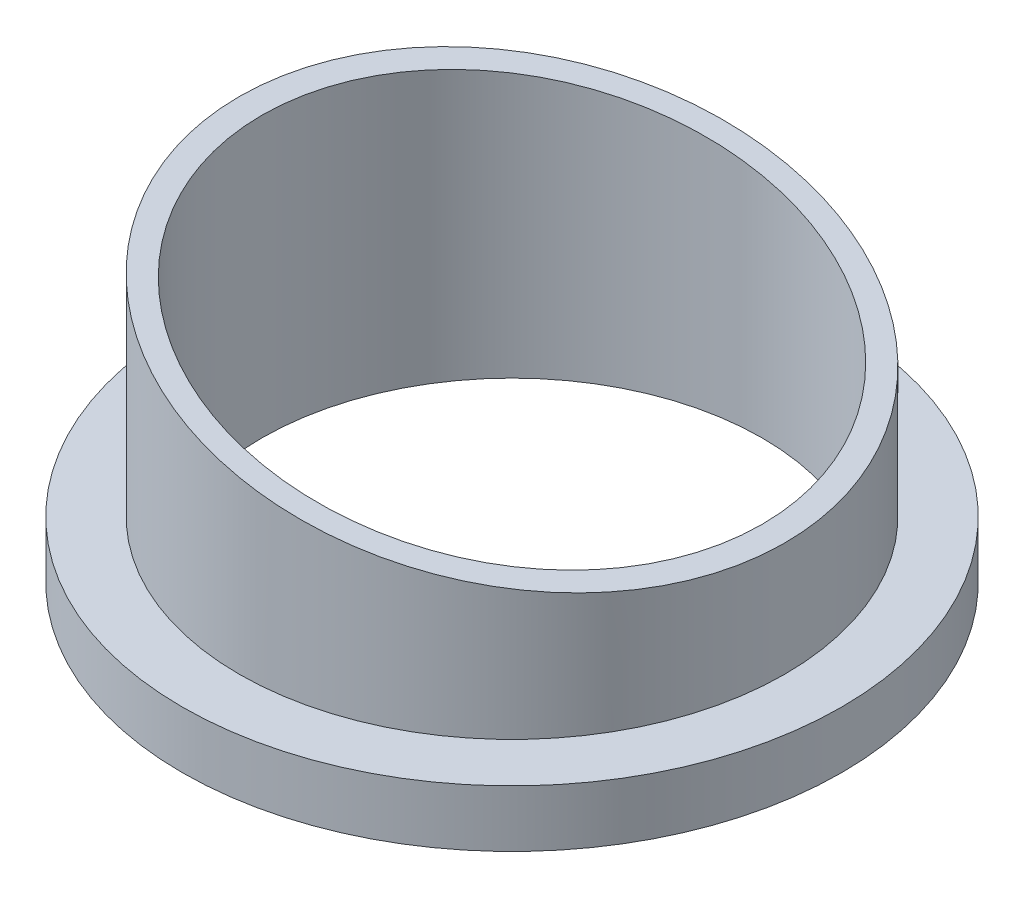
from build123d import *

# Parameters (mm, degrees)
SKETCH1_R               = 14.5
BOSS_EXTRUDE1_DEPTH     = 12.5
CUT_EXTRUDE1_START      = -10
SKETCH2_R               = 14.5
SKETCH2_R_2             = 12
CUT_EXTRUDE1_DEPTH      = 10
SKETCH4_R               = 11
CUT_EXTRUDE2_DEPTH      = 25.015619917
CUT_EXTRUDE3_DEPTH      = 25.015619917
CUT_EXTRUDE3_DEPTH_BACK = 25.015619917


with BuildPart() as part:
    # Sketch1 → Boss-Extrude1 (new body)
    with BuildSketch(Plane(origin=(0, 0, 0), x_dir=(1, 0, 0), z_dir=(0, 1, 0))):
        with Locations(Location((0, 0, 0), (0, 0, 270))):
            Circle(SKETCH1_R)
    extrude(amount=BOSS_EXTRUDE1_DEPTH)

    # Sketch2 → Cut-Extrude1 (cut)
    with BuildSketch(Plane(origin=(0, 12.5, 0), x_dir=(1, 0, 0), z_dir=(0, 1, 0)).offset(CUT_EXTRUDE1_START)):
        with Locations(Location((0, 0, 0), (0, 0, 270))):
            Circle(SKETCH2_R)
        with Locations(Location((0, 0, 0), (0, 0, 270))):
            Circle(SKETCH2_R_2, mode=Mode.SUBTRACT)
    extrude(amount=CUT_EXTRUDE1_DEPTH, mode=Mode.SUBTRACT)

    # Sketch4 → Cut-Extrude2 (cut, through all)
    with BuildSketch(Plane(origin=(0, 12.5, 0), x_dir=(1, 0, 0), z_dir=(0, 1, 0))):
        with Locations(Location((0, 0, 0), (0, 0, 270))):
            Circle(SKETCH4_R)
    extrude(amount=-CUT_EXTRUDE2_DEPTH, mode=Mode.SUBTRACT)

    # Sketch5 → Cut-Extrude3 (cut, two sides: drawn at the far end of the back side and taken through both)
    with BuildSketch(Plane.XY.offset(-CUT_EXTRUDE3_DEPTH_BACK)):
        Polygon((-12, 12.5), (12, 12.5), (12, 7.5), align=None)
    extrude(amount=CUT_EXTRUDE3_DEPTH + CUT_EXTRUDE3_DEPTH_BACK, mode=Mode.SUBTRACT)


solid = part.part
